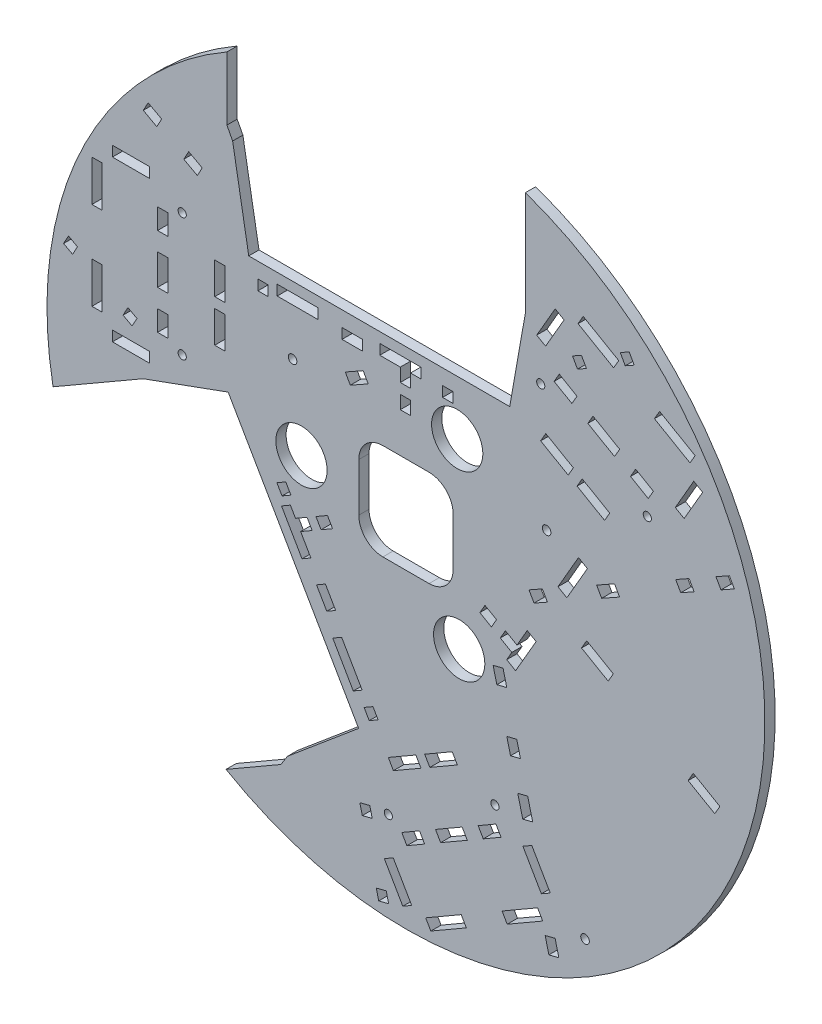
from build123d import *

# Parameters (mm, degrees)
ESQUISSE1_R                   = 175
BOSS_EXTRU_1_DEPTH            = 5
ESQUISSE2_W                   = 18
ESQUISSE2_H                   = 5
ESQUISSE2_W_2                 = 5
ESQUISSE2_H_2                 = 20
ESQUISSE2_H_3                 = 10
ESQUISSE2_H_4                 = 15
ESQUISSE2_H_5                 = 15.5
ESQUISSE2_W_3                 = 20
ESQUISSE2_H_6                 = 6.5
ENL_V_MAT_EXTRU_1_DEPTH       = 5
ESQUISSE6_R                   = 12.5
ENL_V_MAT_EXTRU_6_DEPTH       = 5
TROUS_DE_CENTRAGE_4_0MM1_D    = 4
HOLES_CATCHERS_OF_GLASS_DEPTH = 10
HOLES_BOARDS_SERVO_DEPTH      = 10
ESQUISSE11_W                  = 5
ESQUISSE11_H                  = 5
ESQUISSE11_W_2                = 10
ENL_V_MAT_EXTRU_7_DEPTH       = 5
TROU_TARAUD_M51_D             = 4.2


with BuildPart() as part:
    # Esquisse1 → Boss.-Extru.1 (new body)
    with BuildSketch(Plane.XY):
        with Locations((148.080426897, -12.110171348)):
            Circle(ESQUISSE1_R)
    extrude(amount=BOSS_EXTRU_1_DEPTH)

    # Esquisse2 → Enlèv. mat.-Extru.1 (cut)
    with BuildSketch(Plane.XY.offset(5)):
        Polygon((135.311788567, 53.777441362), (135.311788567, 48.777441362), (145.311788567, 48.777441362), (145.311788567, 42.277441362), (150.311788567, 42.277441362), (150.311788567, 48.777441362), (155.311788567, 48.777441362), (155.311788567, 53.777441362), align=None)
        with Locations((14, 69.777441362)):
            Rectangle(ESQUISSE2_W, ESQUISSE2_H)
        with Locations((-2.5, 52.277441362)):
            Rectangle(ESQUISSE2_W_2, ESQUISSE2_H_2)
        with Locations((-2.5, 9.277441362)):
            Rectangle(ESQUISSE2_W_2, ESQUISSE2_H_2)
        with Locations((14, -8.222558638)):
            Rectangle(ESQUISSE2_W, ESQUISSE2_H)
        with Locations((29.5, 9.277441362)):
            Rectangle(ESQUISSE2_W_2, ESQUISSE2_H_3)
        with Locations((29.5, 30.777441362)):
            Rectangle(ESQUISSE2_W_2, ESQUISSE2_H_4)
        with Locations((29.5, 52.277441362)):
            Rectangle(ESQUISSE2_W_2, ESQUISSE2_H_3)
        with Locations((57.36, 41.027441362)):
            Rectangle(ESQUISSE2_W_2, ESQUISSE2_H_5)
        with Locations((57.36, 20.527441362)):
            Rectangle(ESQUISSE2_W_2, ESQUISSE2_H_5)
        with Locations((95.311788567, 51.277441362)):
            Rectangle(ESQUISSE2_W_3, ESQUISSE2_H)
        with Locations((147.811788567, 34.027441362)):
            Rectangle(ESQUISSE2_W_2, ESQUISSE2_H_6)
        Polygon((292.702456717, 69.607306773), (283.702456717, 54.018849505), (279.372329698, 56.518849505), (288.372329698, 72.107306773), align=None)
        Polygon((289.042202679, 83.267560811), (286.542202679, 78.937433792), (269.221694603, 88.937433792), (271.721694603, 93.267560811), align=None)
        Polygon((251.803110316, 104.767560811), (249.303110316, 100.437433792), (231.982602241, 110.437433792), (234.482602241, 114.767560811), align=None)
        Polygon((225.152475222, 108.607306773), (216.152475222, 93.018849505), (211.822348203, 95.518849505), (220.822348203, 111.107306773), align=None)
        Polygon((231.472983297, 79.55474789), (228.972983297, 75.224620871), (220.31272926, 80.224620871), (222.81272926, 84.55474789), align=None)
        Polygon((252.257592988, 67.55474789), (249.757592988, 63.224620871), (236.767211932, 70.724620871), (239.267211932, 75.05474789), align=None)
        Polygon((268.71207566, 58.05474789), (266.21207566, 53.724620871), (257.551821622, 58.724620871), (260.051821622, 63.05474789), align=None)
        Polygon((247.420859728, 38.17728014), (244.920859728, 33.847153121), (231.497465969, 41.597153121), (233.997465969, 45.92728014), align=None)
        Polygon((229.66733895, 48.42728014), (227.16733895, 44.097153121), (213.743945192, 51.847153121), (216.243945192, 56.17728014), align=None)
        Polygon((211.525092463, -33.996012539), (207.194965444, -31.496012539), (202.194965444, -40.156266577), (196.56580032, -36.906266577), (194.06580032, -41.236393596), (199.694965444, -44.486393596), (197.194965444, -48.816520615), (201.525092463, -51.316520615), align=None)
        Polygon((236.525092463, 9.30525765), (226.525092463, -8.015250425), (222.194965444, -5.515250425), (232.194965444, 11.80525765), align=None)
        Polygon((192.235673301, -34.406266577), (189.735673301, -38.736393596), (184.106508176, -35.486393596), (186.606508176, -31.156266577), align=None)
        Polygon((146.538823973, -178.215262181), (137.538823973, -162.626804912), (141.868950992, -160.126804912), (150.868950992, -175.715262181), align=None)
        Polygon((160.199078011, -181.875516218), (157.699078011, -177.545389199), (175.019586086, -167.545389199), (177.519586086, -171.875516218), align=None)
        Polygon((197.438170373, -160.375516218), (194.938170373, -156.045389199), (212.258678449, -146.045389199), (214.758678449, -150.375516218), align=None)
        Polygon((214.088805468, -139.215262181), (205.088805468, -123.626804912), (209.418932487, -121.126804912), (218.418932487, -136.715262181), align=None)
        Polygon((185.768297392, -130.162703297), (183.268297392, -125.832576278), (191.92855143, -120.832576278), (194.42855143, -125.162703297), align=None)
        Polygon((164.983687701, -142.162703297), (162.483687701, -137.832576278), (175.474068758, -130.332576278), (177.974068758, -134.662703297), align=None)
        Polygon((148.52920503, -151.662703297), (146.02920503, -147.332576278), (154.689459067, -142.332576278), (157.189459067, -146.662703297), align=None)
        Polygon((141.960420962, -123.285235548), (139.460420962, -118.955108529), (152.88381472, -111.205108529), (155.38381472, -115.535235548), align=None)
        Polygon((159.713941739, -113.035235548), (157.213941739, -108.705108529), (170.637335498, -100.955108529), (173.137335498, -105.285235548), align=None)
        Polygon((97.404399659, -56.111942869), (101.734526678, -53.611942869), (96.734526678, -44.951688831), (102.363691803, -41.701688831), (99.863691803, -37.371561812), (94.234526678, -40.621561812), (91.734526678, -36.291434793), (87.404399659, -38.791434793), align=None)
        Polygon((122.404399659, -99.413213058), (112.404399659, -82.092704982), (116.734526678, -79.592704982), (126.734526678, -96.913213058), align=None)
        Polygon((106.693818822, -39.201688831), (104.193818822, -34.871561812), (109.822983946, -31.621561812), (112.322983946, -35.951688831), align=None)
    extrude(amount=-ENL_V_MAT_EXTRU_1_DEPTH, mode=Mode.SUBTRACT)

    # Esquisse6 → Enlèv. mat.-Extru.6 (cut)
    with BuildSketch(Plane.XY.offset(5)):
        Polygon((90.338320311, -143.014752793), (87.112635197, -148.095942881), (20.531439882, -186.536613919), (-52.230591968, -60.509077893), (19.945575289, -18.838148298), (61.399751081, -3.750062223), (125.008255225, -113.923223194), align=None)
        with Locations((97.149840124, -12.67103282)):
            Circle(ESQUISSE6_R)
        Polygon((63.584787187, 103.348250546), (60.797190046, 108.682370842), (60.797190046, 185.563712918), (206.321253746, 185.563712918), (206.321253746, 102.221853729), (198.660831685, 58.777441362), (71.443823398, 58.777441362), align=None)
        with BuildLine():
            ThreePointArc((125.080426897, -0.360171348), (128.521922218, 7.94833333), (136.830426897, 11.389828652))
            Line((136.830426897, 11.389828652), (159.330426897, 11.389828652))
            ThreePointArc((159.330426897, 11.389828652), (167.638931576, 7.94833333), (171.080426897, -0.360171348))
            Line((171.080426897, -0.360171348), (171.080426897, -23.860171348))
            ThreePointArc((171.080426897, -23.860171348), (167.638931576, -32.168676027), (159.330426897, -35.610171348))
            Line((159.330426897, -35.610171348), (136.830426897, -35.610171348))
            ThreePointArc((136.830426897, -35.610171348), (128.521922218, -32.168676027), (125.080426897, -23.860171348))
            Line((125.080426897, -23.860171348), (125.080426897, -0.360171348))
        make_face()
        with Locations((174.031440566, -55.936922587)):
            Circle(ESQUISSE6_R)
        with Locations((173.06, 32.277441362)):
            Circle(ESQUISSE6_R)
        Polygon((288.132892031, -51.307411432), (285.632892031, -55.637538451), (298.623273088, -63.137538451), (301.123273088, -58.807411432), align=None)
        Polygon((236.171367804, -21.307411432), (233.671367804, -25.637538451), (246.66174886, -33.137538451), (249.16174886, -28.807411432), align=None)
    extrude(amount=-ENL_V_MAT_EXTRU_6_DEPTH, mode=Mode.SUBTRACT)

    # Trous de centrage Ø4.0mm1 (through all)
    with Locations(Plane(origin=(148.080426897, -12.110171348, -78), x_dir=(1, 0, 0), z_dir=(0, 0, -1))):
        with Locations((65.70121345, -88.022614393), (117.662737677, -58.022614393), (-109.080426897, -72.887612711), (-109.080426897, -12.887612711), (-8.58231078, 130.910227103), (43.379213447, 100.910227103)):
            Hole(TROUS_DE_CENTRAGE_4_0MM1_D / 2)

    # Esquisse9 → Holes catchers of glass (cut)
    with BuildSketch(Plane.XY.offset(5)):
        Polygon((301.647255965, 32.874727734), (299.200467122, 37.235143352), (305.741090548, 40.905326617), (308.187879391, 36.544910999), align=None)
        Polygon((282.025385687, 21.864177939), (279.578596844, 26.224593557), (286.11922027, 29.894776822), (288.566009113, 25.534361204), align=None)
        Polygon((252.208863696, 5.133035829), (249.762074852, 9.493451446), (241.041243617, 4.599873759), (243.488032461, 0.239458142), align=None)
        Polygon((214.608404145, -10.232560209), (217.055192988, -14.592975826), (210.514569562, -18.263159091), (208.067780719, -13.902743474), align=None)
        Polygon((259.347334993, 106.606466519), (254.986919375, 104.159677675), (252.540130532, 108.520093293), (256.900546149, 110.966882136), align=None)
        Polygon((236.069559733, 93.544454591), (231.709144116, 91.097665748), (229.262355272, 95.458081365), (233.62277089, 97.904870209), align=None)
        Polygon((129.675418669, 33.842806815), (120.954587434, 28.949229128), (118.507798591, 33.309644745), (127.228629826, 38.203222432), align=None)
        Polygon((-16.43844555, 23.279140051), (-12.045948181, 20.890423478), (-14.434664754, 16.49792611), (-18.827162123, 18.886642683), align=None)
        Polygon((12.552037084, 7.51361067), (16.944534453, 5.124894098), (14.55581788, 0.732396729), (10.163320511, 3.121113302), align=None)
        Polygon((22.412737241, 98.907081949), (29.001483294, 95.32400709), (26.612766722, 90.931509721), (20.024020668, 94.514584581), align=None)
        Polygon((42.178975401, 88.157857372), (48.767721454, 84.574782512), (46.379004881, 80.182285143), (39.790258828, 83.765360003), align=None)
        Polygon((126.799616111, -149.834276272), (125.585690653, -144.983875775), (130.43609115, -143.769950316), (131.650016608, -148.620350813), align=None)
        Polygon((134.811524138, -181.846919552), (133.597598679, -176.996519055), (138.447999176, -175.782593596), (139.661924635, -180.632994093), align=None)
        Polygon((190.561972498, -54.501375823), (195.412372995, -53.287450364), (197.233261183, -60.56305111), (192.382860686, -61.776976568), align=None)
        Polygon((202.088963017, -79.964653097), (197.23856252, -81.178578556), (199.059450708, -88.454179302), (203.909851205, -87.240253843), align=None)
        Polygon((222.604303267, -161.936421496), (217.75390277, -163.150346955), (215.933014582, -155.874746209), (220.783415079, -154.660820751), align=None)
    extrude(amount=-HOLES_CATCHERS_OF_GLASS_DEPTH, mode=Mode.SUBTRACT)

    # Esquisse10 → Holes boards servo (cut)
    with BuildSketch(Plane.XY.offset(5)):
        Polygon((89.496120404, -27.614401399), (91.996120404, -31.944528418), (87.66720686, -34.443827818), (85.16720686, -30.113700799), align=None)
    extrude(amount=-HOLES_BOARDS_SERVO_DEPTH, mode=Mode.SUBTRACT)

    # Esquisse11 → Enlèv. mat.-Extru.7 (cut)
    with BuildSketch(Plane.XY.offset(5)):
        Polygon((109.482860628, -72.232450944), (104.482860628, -63.572196906), (108.812987647, -61.072196906), (113.812987647, -69.732450944), align=None)
        Polygon((130.165993385, -108.056687739), (134.496120404, -105.556687739), (131.996120404, -101.22656072), (127.665993385, -103.72656072), align=None)
        Polygon((207.430235035, -101.306415284), (209.858085952, -111.007216278), (205.007685455, -112.221141737), (202.579834538, -102.520340743), align=None)
        with Locations((168.425291316, 48.777441362)):
            Rectangle(ESQUISSE11_W, ESQUISSE11_H)
        with Locations((121.925291316, 48.777441362)):
            Rectangle(ESQUISSE11_W_2, ESQUISSE11_H)
        with Locations((78.425291316, 48.777441362)):
            Rectangle(ESQUISSE11_W, ESQUISSE11_H)
    extrude(amount=-ENL_V_MAT_EXTRU_7_DEPTH, mode=Mode.SUBTRACT)

    # Trou taraudé M51 (through all)
    with Locations(Plane(origin=(148.080426897, -12.110171348, 262), x_dir=(-1, 0, 0), z_dir=(0, 0, 1))):
        with Locations((-68.568956805, -27.662548456), (55.280905682, -37.98337033), (-87.299337242, 135.559338217)):
            Hole(TROU_TARAUD_M51_D / 2)


solid = part.part
